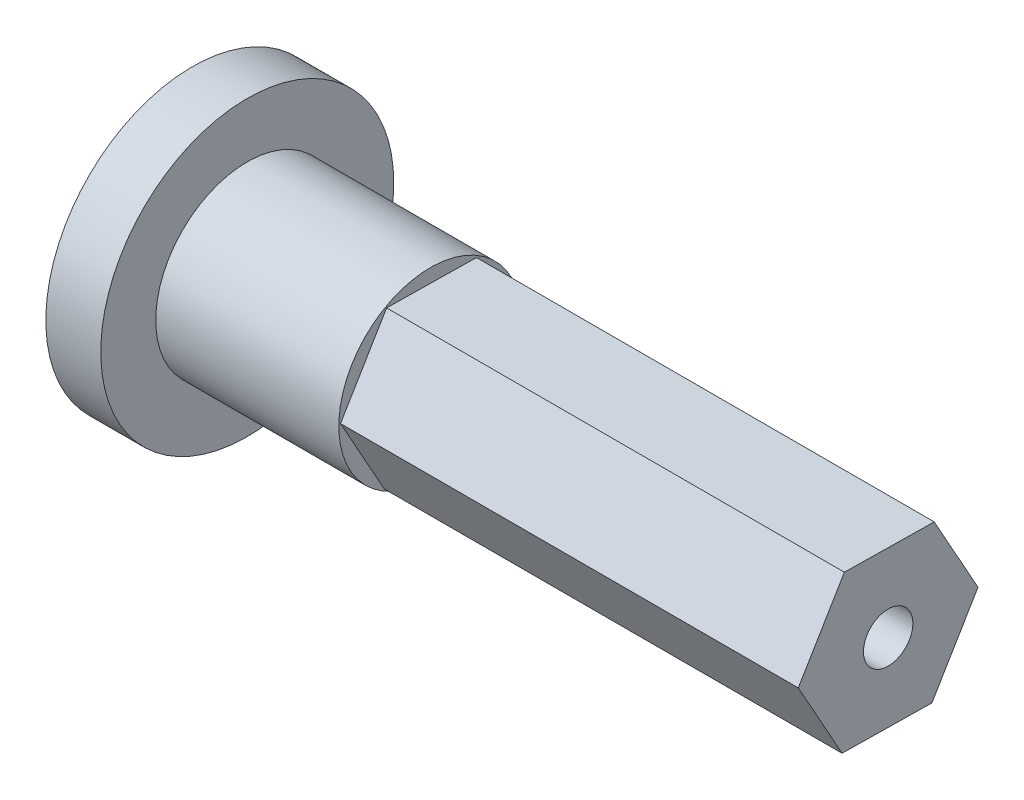
from build123d import *

# Parameters (mm, degrees)
SKETCH2_R           = 8
BOSS_EXTRUDE1_DEPTH = 3
SKETCH3_R           = 5
BOSS_EXTRUDE2_DEPTH = 10
BOSS_EXTRUDE3_DEPTH = 25
SKETCH8_R           = 1.35
CUT_EXTRUDE3_DEPTH  = 10
CUT_EXTRUDE5_DEPTH  = 23.5


with BuildPart() as part:
    # Sketch2 → Boss-Extrude1 (new body)
    with BuildSketch(Plane(origin=(0, 0, 0), x_dir=(0, 0, -1), z_dir=(1, 0, 0))):
        Circle(SKETCH2_R)
    extrude(amount=BOSS_EXTRUDE1_DEPTH)

    # Sketch3 → Boss-Extrude2 (add)
    with BuildSketch(Plane(origin=(3, 0, 0), x_dir=(0, 0, -1), z_dir=(1, 0, 0))):
        Circle(SKETCH3_R)
    extrude(amount=BOSS_EXTRUDE2_DEPTH)

    # Sketch6 → Boss-Extrude3 (add)
    with BuildSketch(Plane(origin=(13, 0, 0), x_dir=(0, 0, -1), z_dir=(1, 0, 0))):
        Polygon((2.389986953, -4.286174949), (4.906929868, -0.073298058), (2.516942915, 4.212876891), (-2.389986953, 4.286174949), (-4.906929868, 0.073298058), (-2.516942915, -4.212876891), align=None)
    extrude(amount=BOSS_EXTRUDE3_DEPTH)

    # Sketch8 → Cut-Extrude3 (cut)
    with BuildSketch(Plane(origin=(38, 0, 0), x_dir=(0, 0, -1), z_dir=(1, 0, 0))):
        Circle(SKETCH8_R)
    extrude(amount=-CUT_EXTRUDE3_DEPTH, mode=Mode.SUBTRACT)

    # Sketch5 → Cut-Extrude5 (cut)
    with BuildSketch(Plane.ZY):
        Polygon((0, -2.309401077), (2, -1.154700538), (2, 1.154700538), (0, 2.309401077), (-2, 1.154700538), (-2, -1.154700538), align=None)
    extrude(amount=-CUT_EXTRUDE5_DEPTH, mode=Mode.SUBTRACT)


solid = part.part
